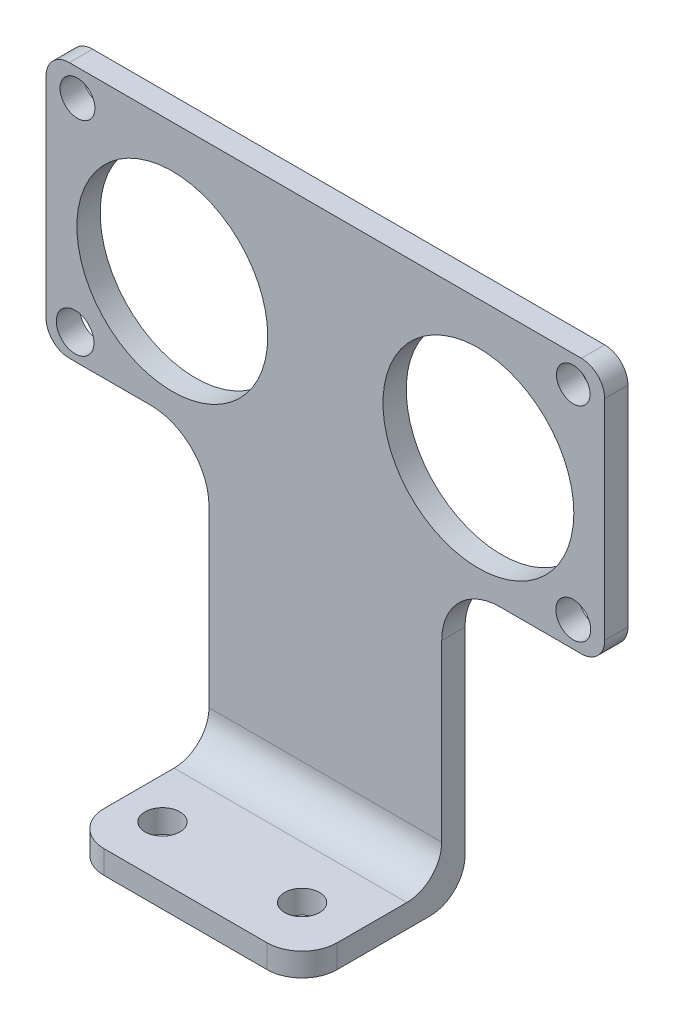
from build123d import *

# Parameters (mm, degrees)
BOSS_EXTRUDE1_DEPTH = 2
SKETCH3_R           = 8.2
CUT_EXTRUDE2_DEPTH  = 43.547600128
SKETCH4_R           = 1.5
SKETCH4_R_2         = 1.618660888
SKETCH4_R_3         = 1.441296675
CUT_EXTRUDE3_DEPTH  = 43.547600128
SKETCH6_W           = 20
SKETCH6_H           = 2
BOSS_EXTRUDE2_DEPTH = 12
FILLET1_R           = 3
FILLET2_R           = 3
SKETCH7_R           = 1.5
CUT_EXTRUDE4_DEPTH  = 54.930795553
FILLET3_R           = 3


with BuildPart() as part:
    # Sketch1 → Boss-Extrude1 (new body)
    with BuildSketch(Plane.XY):
        with BuildLine():
            Line((-19.779193206, 13.552016985), (24.220806794, 13.552016985))
            ThreePointArc((24.220806794, 13.552016985), (25.635020356, 12.966230548), (26.220806794, 11.552016985))
            Line((26.220806794, 11.552016985), (26.220806794, -6.447983015))
            ThreePointArc((26.220806794, -6.447983015), (25.635020356, -7.862196577), (24.220806794, -8.447983015))
            Line((24.220806794, -8.447983015), (17.220806794, -8.447983015))
            ThreePointArc((17.220806794, -8.447983015), (13.685272888, -9.912449109), (12.220806794, -13.447983015))
            Line((12.220806794, -13.447983015), (12.220806794, -33.447983015))
            Line((12.220806794, -33.447983015), (-7.779193206, -33.447983015))
            Line((-7.779193206, -33.447983015), (-7.779193206, -13.447983015))
            ThreePointArc((-7.779193206, -13.447983015), (-9.2436593, -9.912449109), (-12.779193206, -8.447983015))
            Line((-12.779193206, -8.447983015), (-19.779193206, -8.447983015))
            ThreePointArc((-19.779193206, -8.447983015), (-21.193406768, -7.862196577), (-21.779193206, -6.447983015))
            Line((-21.779193206, -6.447983015), (-21.779193206, 11.552016985))
            ThreePointArc((-21.779193206, 11.552016985), (-21.193406768, 12.966230548), (-19.779193206, 13.552016985))
        make_face()
    extrude(amount=BOSS_EXTRUDE1_DEPTH)

    # Sketch3 → Cut-Extrude2 (cut, through all)
    with BuildSketch(Plane.XY.offset(2)):
        with Locations((-10.929193206, 1.702016985)):
            Circle(SKETCH3_R)
        with Locations((15.370806794, 1.702016985)):
            Circle(SKETCH3_R)
    extrude(amount=-CUT_EXTRUDE2_DEPTH, mode=Mode.SUBTRACT)

    # Sketch4 → Cut-Extrude3 (cut, through all)
    with BuildSketch(Plane.XY.offset(2)):
        with Locations((-19.079193206, 11.252016985)):
            Circle(SKETCH4_R)
        with Locations((-19.279193206, -6.247983015)):
            Circle(SKETCH4_R_2)
        with Locations((23.520806794, 11.252016985)):
            Circle(SKETCH4_R_3)
        with Locations((23.520806794, -6.247983015)):
            Circle(SKETCH4_R)
    extrude(amount=-CUT_EXTRUDE3_DEPTH, mode=Mode.SUBTRACT)

    # Sketch6 → Boss-Extrude2 (add)
    with BuildSketch(Plane.XY.offset(2)):
        with Locations((2.220806794, -32.447983015)):
            Rectangle(SKETCH6_W, SKETCH6_H)
    extrude(amount=BOSS_EXTRUDE2_DEPTH)

    # Fillet1
    fillet1_edges = [part.edges().sort_by_distance(p)[0] for p in [
        (2.220806794, -33.447983015, 0),
    ]]
    fillet(fillet1_edges, radius=FILLET1_R)

    # Fillet2
    fillet2_edges = [part.edges().sort_by_distance(p)[0] for p in [
        (2.220806794, -31.447983015, 2),
    ]]
    fillet(fillet2_edges, radius=FILLET2_R)

    # Sketch7 → Cut-Extrude4 (cut, through all)
    with BuildSketch(Plane(origin=(0, -31.447983015, 0), x_dir=(1, 0, 0), z_dir=(0, 1, 0))):
        with Locations(Location((-4.279193206, -9.5, 0), (0, 0, 270))):
            Circle(SKETCH7_R)
        with Locations(Location((7.720806794, -9.5, 0), (0, 0, 270))):
            Circle(SKETCH7_R)
    extrude(amount=-CUT_EXTRUDE4_DEPTH, mode=Mode.SUBTRACT)

    # Fillet3
    fillet3_edges = [part.edges().sort_by_distance(p)[0] for p in [
        (-7.779193206, -32.447983015, 14),
        (12.220806794, -32.447983015, 14),
    ]]
    fillet(fillet3_edges, radius=FILLET3_R)


solid = part.part
